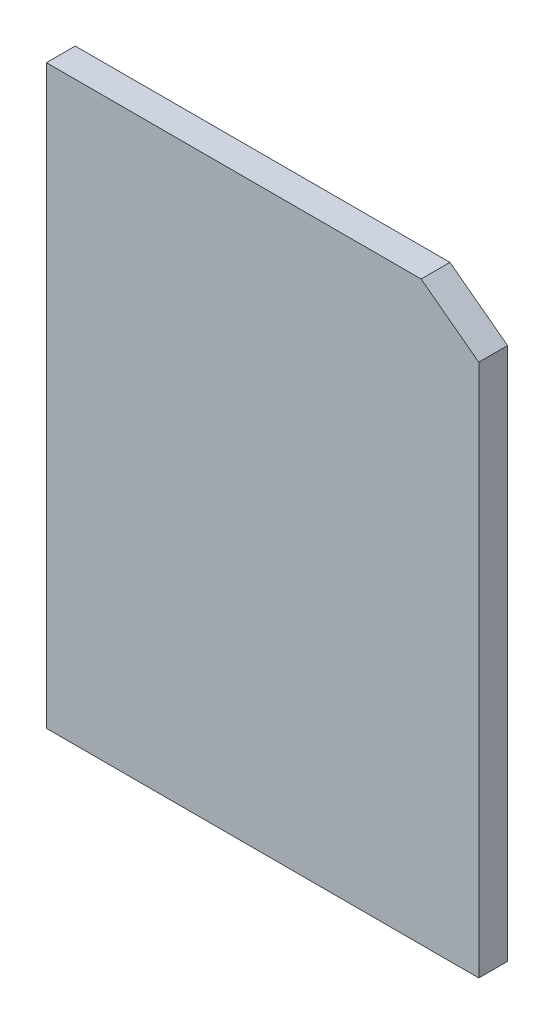
from build123d import *

# Parameters (mm, degrees)
EXTRUDE_1_DEPTH = 0.4


with BuildPart() as part:
    # 草图1 → 凸台-拉伸1 (new body)
    with BuildSketch(Plane.XY):
        Polygon((-3.680672269, 2.05210084), (-3.680672269, -5.94789916), (2.319327731, -5.94789916), (2.319327731, 1.45210084), (1.519327731, 2.05210084), align=None)
    extrude(amount=EXTRUDE_1_DEPTH)


solid = part.part
